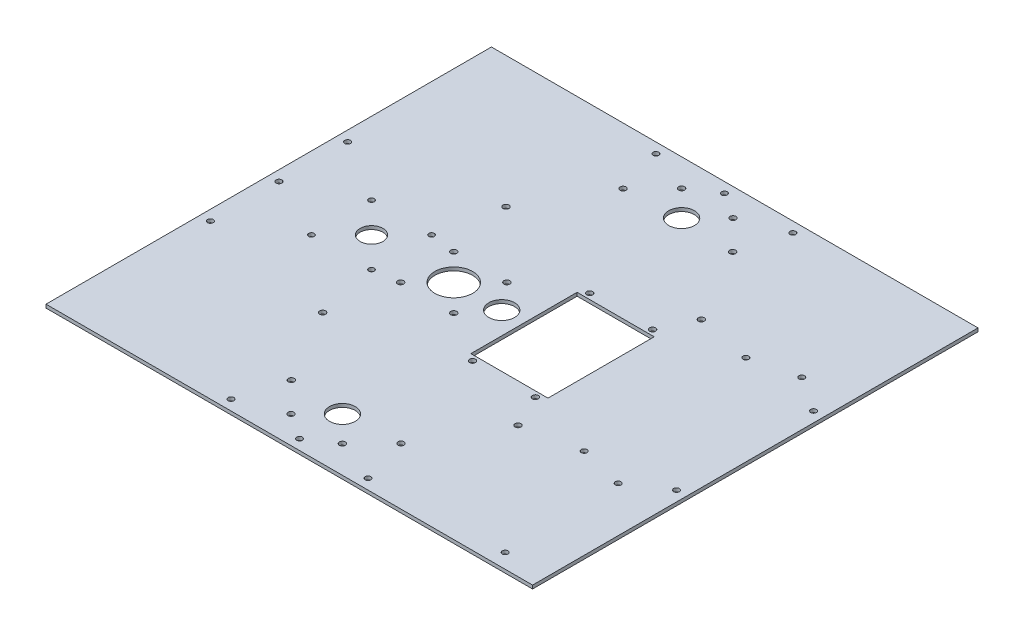
from build123d import *

# Parameters (mm, degrees)
SKETCH_1_W          = 284
SKETCH_1_H          = 260
EXTRUDE_1_DEPTH     = 2
SKETCH_2_R          = 6.65
SKETCH_2_R_2        = 1.6
SKETCH_2_R_3        = 11.05
SKETCH_2_R_4        = 1.75
SKETCH_2_R_5        = 1.65
SKETCH_2_W          = 45
SKETCH_2_H          = 62
CUT_EXTRUDE_1_DEPTH = 10
SKETCH_3_R          = 1.75
CUT_EXTRUDE_2_DEPTH = 10
SKETCH_4_R          = 7.5
CUT_EXTRUDE_3_DEPTH = 10
SKETCH_5_R          = 1.75
CUT_EXTRUDE_4_DEPTH = 4.5


with BuildPart() as part:
    # 草图1 → 凸台-拉伸1 (new body)
    with BuildSketch(Plane(origin=(0, 0, 0), x_dir=(1, 0, 0), z_dir=(0, 1, 0))):
        Rectangle(SKETCH_1_W, SKETCH_1_H)
    extrude(amount=EXTRUDE_1_DEPTH)

    # 草图2 → 切除-拉伸1 (cut)
    with BuildSketch(Plane(origin=(0, 2, 0), x_dir=(1, 0, 0), z_dir=(0, 1, 0))):
        with Locations(Location((-82, 0, 0), (0, 0, 270))):
            Circle(SKETCH_2_R)
        with Locations(Location((-99.536248173, 17.536248173, 0), (0, 0, 270))):
            Circle(SKETCH_2_R_2)
        with Locations(Location((-64.463751827, 17.536248173, 0), (0, 0, 270))):
            Circle(SKETCH_2_R_2)
        with Locations(Location((-64.463751827, -17.536248173, 0), (0, 0, 270))):
            Circle(SKETCH_2_R_2)
        with Locations(Location((-99.536248173, -17.536248173, 0), (0, 0, 270))):
            Circle(SKETCH_2_R_2)
        with Locations(Location((-34, 0, 0), (0, 0, 270))):
            Circle(SKETCH_2_R_3)
        with Locations(Location((-18.5, 15.5, 0), (0, 0, 270))):
            Circle(SKETCH_2_R_4)
        with Locations(Location((-18.5, -15.5, 0), (0, 0, 270))):
            Circle(SKETCH_2_R_4)
        with Locations(Location((-49.5, -15.5, 0), (0, 0, 270))):
            Circle(SKETCH_2_R_4)
        with Locations(Location((-49.5, 15.5, 0), (0, 0, 270))):
            Circle(SKETCH_2_R_4)
        with Locations(Location((-40, 124, 0), (0, 0, 270))):
            Circle(SKETCH_2_R_5)
        with Locations(Location((0, 124, 0), (0, 0, 270))):
            Circle(SKETCH_2_R_5)
        with Locations(Location((40, 124, 0), (0, 0, 270))):
            Circle(SKETCH_2_R_5)
        with Locations(Location((117.5, -121.5, 0), (0, 0, 270))):
            Circle(SKETCH_2_R_5)
        with Locations(Location((40, -124, 0), (0, 0, 270))):
            Circle(SKETCH_2_R_5)
        with Locations(Location((0, -124, 0), (0, 0, 270))):
            Circle(SKETCH_2_R_5)
        with Locations(Location((-40, -124, 0), (0, 0, 270))):
            Circle(SKETCH_2_R_5)
        with Locations(Location((-136, 40, 0), (0, 0, 270))):
            Circle(SKETCH_2_R_5)
        with Locations(Location((-136, -40, 0), (0, 0, 270))):
            Circle(SKETCH_2_R_5)
        with Locations(Location((-136, 0, 0), (0, 0, 270))):
            Circle(SKETCH_2_R_5)
        with Locations(Location((136, 40, 0), (0, 0, 270))):
            Circle(SKETCH_2_R_5)
        with Locations(Location((136, -40, 0), (0, 0, 270))):
            Circle(SKETCH_2_R_5)
        with Locations(Location((115.551101602, -53.6, 0), (0, 0, 270))):
            Circle(SKETCH_2_R_5)
        with Locations(Location((89.320585023, -47.2, 0), (0, 0, 270))):
            Circle(SKETCH_2_R_5)
        with Locations(Location((115.551101602, 53.6, 0), (0, 0, 270))):
            Circle(SKETCH_2_R_5)
        with Locations(Location((89.320585023, 47.2, 0), (0, 0, 270))):
            Circle(SKETCH_2_R_5)
        with Locations(Location((11.15, -34.2, 0), (0, 0, 270))):
            Circle(SKETCH_2_R_4)
        with Locations(Location((47.85, -34.2, 0), (0, 0, 270))):
            Circle(SKETCH_2_R_4)
        with Locations(Location((47.85, 34.2, 0), (0, 0, 270))):
            Circle(SKETCH_2_R_4)
        with Locations(Location((11.15, 34.2, 0), (0, 0, 270))):
            Circle(SKETCH_2_R_4)
        with Locations((29.5, 0)):
            Rectangle(SKETCH_2_W, SKETCH_2_H)
    extrude(amount=-CUT_EXTRUDE_1_DEPTH, mode=Mode.SUBTRACT)

    # 草图3 → 切除-拉伸2 (cut)
    with BuildSketch(Plane(origin=(0, 2, 0), x_dir=(1, 0, 0), z_dir=(0, 1, 0))):
        with Locations(Location((15, -114, 0), (0, 0, 270))):
            Circle(SKETCH_3_R)
        with Locations(Location((-15, -114, 0), (0, 0, 270))):
            Circle(SKETCH_3_R)
        with Locations(Location((15, 114, 0), (0, 0, 270))):
            Circle(SKETCH_3_R)
        with Locations(Location((-15, 114, 0), (0, 0, 270))):
            Circle(SKETCH_3_R)
    extrude(amount=-CUT_EXTRUDE_2_DEPTH, mode=Mode.SUBTRACT)

    # 草图4 → 切除-拉伸3 (cut)
    with BuildSketch(Plane(origin=(0, 2, 0), x_dir=(1, 0, 0), z_dir=(0, 1, 0))):
        with Locations(Location((-6, 0, 0), (0, 0, 270))):
            Circle(SKETCH_4_R)
        with Locations(Location((0, 99, 0), (0, 0, 270))):
            Circle(SKETCH_4_R)
        with Locations(Location((0, -99, 0), (0, 0, 270))):
            Circle(SKETCH_4_R)
    extrude(amount=-CUT_EXTRUDE_3_DEPTH, mode=Mode.SUBTRACT)

    # 草图5 → 切除-拉伸4 (cut)
    with BuildSketch(Plane(origin=(0, 2, 0), x_dir=(1, 0, 0), z_dir=(0, 1, 0))):
        with Locations(Location((57.002701991, 53.5, 0), (0, 0, 270))):
            Circle(SKETCH_5_R)
        with Locations(Location((32.002701991, 96.801270189, 0), (0, 0, 270))):
            Circle(SKETCH_5_R)
        with Locations(Location((-32.002701991, 96.801270189, 0), (0, 0, 270))):
            Circle(SKETCH_5_R)
        with Locations(Location((-57.002701991, 53.5, 0), (0, 0, 270))):
            Circle(SKETCH_5_R)
        with Locations(Location((-57.002701991, -53.5, 0), (0, 0, 270))):
            Circle(SKETCH_5_R)
        with Locations(Location((-32.002701991, -96.801270189, 0), (0, 0, 270))):
            Circle(SKETCH_5_R)
        with Locations(Location((32.002701991, -96.801270189, 0), (0, 0, 270))):
            Circle(SKETCH_5_R)
        with Locations(Location((57.002701991, -53.5, 0), (0, 0, 270))):
            Circle(SKETCH_5_R)
    extrude(amount=-CUT_EXTRUDE_4_DEPTH, mode=Mode.SUBTRACT)


solid = part.part
